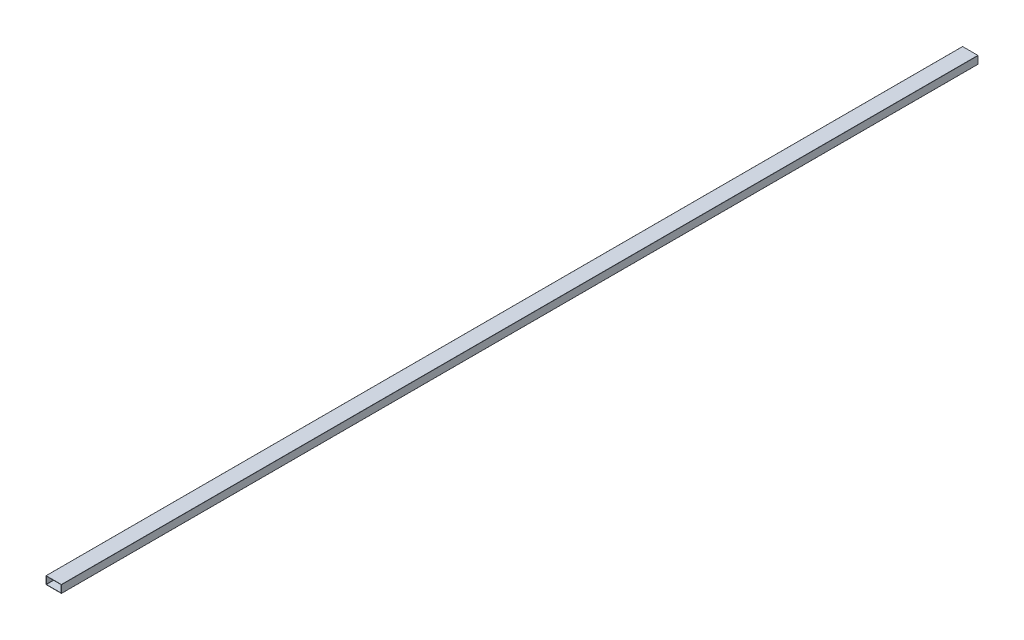
from build123d import *

# Parameters (mm, degrees)
CROQUIS1_W              = 101.6
CROQUIS1_H              = 50.8
CROQUIS1_W_2            = 97.82
CROQUIS1_H_2            = 47.02
SALIENTE_EXTRUIR1_DEPTH = 6000
REDONDEO1_R             = 1


with BuildPart() as part:
    # Croquis1 → Saliente-Extruir1 (new body)
    with BuildSketch(Plane.XY):
        Rectangle(CROQUIS1_W, CROQUIS1_H)
        Rectangle(CROQUIS1_W_2, CROQUIS1_H_2, mode=Mode.SUBTRACT)
    extrude(amount=-SALIENTE_EXTRUIR1_DEPTH)

    # Redondeo1
    redondeo1_edges = [part.edges().sort_by_distance(p)[0] for p in [
        (48.91, -23.51, -3000),
        (-48.91, -23.51, -3000),
        (-48.91, 23.51, -3000),
        (48.91, 23.51, -3000),
        (50.8, -25.4, -3000),
        (-50.8, -25.4, -3000),
        (-50.8, 25.4, -3000),
        (50.8, 25.4, -3000),
    ]]
    fillet(redondeo1_edges, radius=REDONDEO1_R)


solid = part.part
